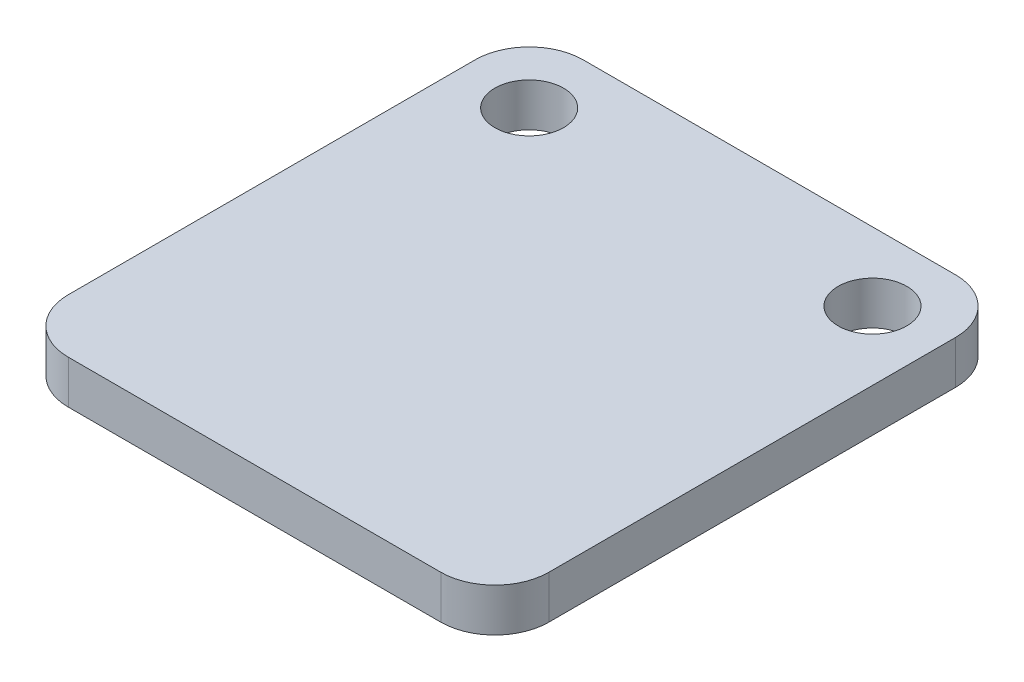
from build123d import *

# Parameters (mm, degrees)
BOSS_EXTRUDE1_DEPTH = 1.6
SKETCH2_R           = 1.27
CUT_EXTRUDE1_DEPTH  = 1.6


with BuildPart() as part:
    # Sketch1 → Boss-Extrude1 (new body)
    with BuildSketch(Plane(origin=(0, 0, 0), x_dir=(1, 0, 0), z_dir=(0, 1, 0))):
        with BuildLine():
            Line((-6.89, 9.525), (6.89, 9.525))
            ThreePointArc((6.89, 9.525), (8.304213562, 8.939213562), (8.89, 7.525))
            Line((8.89, 7.525), (8.89, -7.525))
            ThreePointArc((8.89, -7.525), (8.304213562, -8.939213562), (6.89, -9.525))
            Line((6.89, -9.525), (-6.89, -9.525))
            ThreePointArc((-6.89, -9.525), (-8.304213562, -8.939213562), (-8.89, -7.525))
            Line((-8.89, -7.525), (-8.89, 7.525))
            ThreePointArc((-8.89, 7.525), (-8.304213562, 8.939213562), (-6.89, 9.525))
        make_face()
    extrude(amount=BOSS_EXTRUDE1_DEPTH)

    # Sketch2 → Cut-Extrude1 (cut)
    with BuildSketch(Plane(origin=(0, 1.6, 0), x_dir=(1, 0, 0), z_dir=(0, 1, 0))):
        with Locations(Location((-6.35, 6.985, 0), (0, 0, 270))):
            Circle(SKETCH2_R)
        with Locations(Location((6.35, 6.985, 0), (0, 0, 270))):
            Circle(SKETCH2_R)
    extrude(amount=-CUT_EXTRUDE1_DEPTH, mode=Mode.SUBTRACT)


solid = part.part
